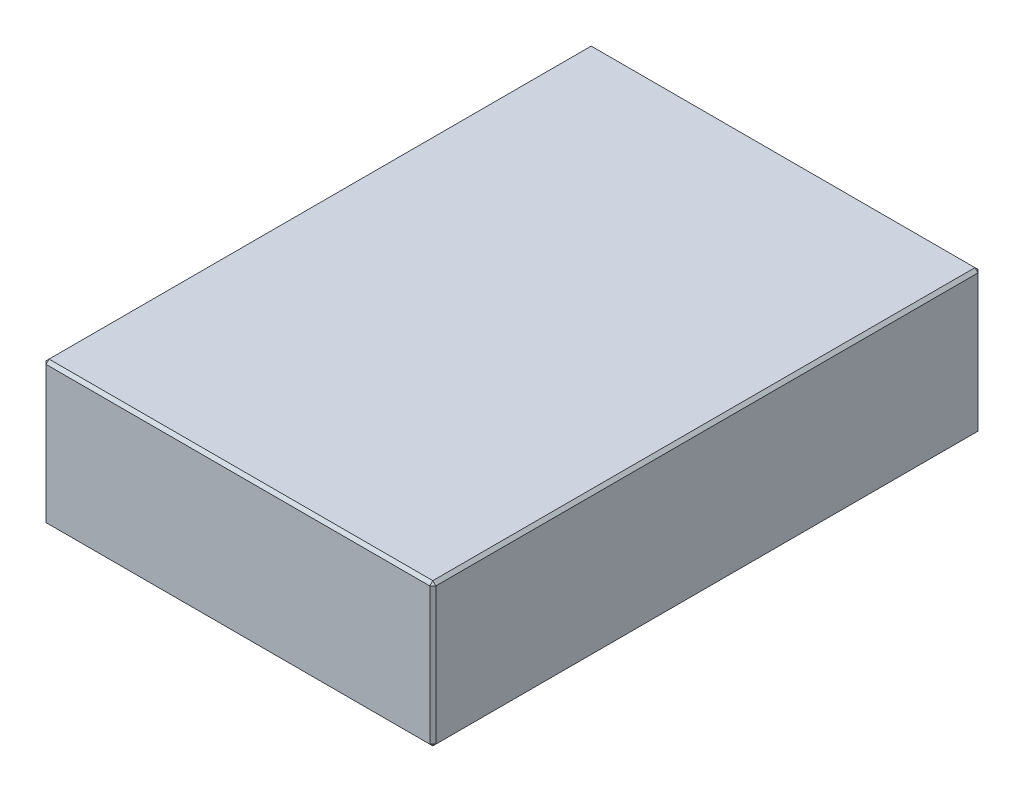
from build123d import *

# Parameters (mm, degrees)
SKETCH1_W           = 64
SKETCH1_H           = 90
BOSS_EXTRUDE1_DEPTH = 23.5
CHAMFER1_SIZE       = 0.5


with BuildPart() as part:
    # Sketch1 → Boss-Extrude1 (new body)
    with BuildSketch(Plane(origin=(0, 0, 0), x_dir=(1, 0, 0), z_dir=(0, 1, 0))):
        with Locations((32, 45)):
            Rectangle(SKETCH1_W, SKETCH1_H)
    extrude(amount=BOSS_EXTRUDE1_DEPTH)

    # Chamfer1
    chamfer1_edges = [part.edges().sort_by_distance(p)[0] for p in [
        (64, 23.5, -45),
        (32, 23.5, -90),
        (0, 23.5, -45),
        (32, 0, -90),
        (64, 0, -45),
        (32, 0, 0),
        (0, 0, -45),
        (0, 11.75, -90),
        (64, 11.75, -90),
        (64, 11.75, 0),
        (0, 11.75, 0),
        (32, 23.5, 0),
    ]]
    chamfer(chamfer1_edges, length=CHAMFER1_SIZE)


solid = part.part
